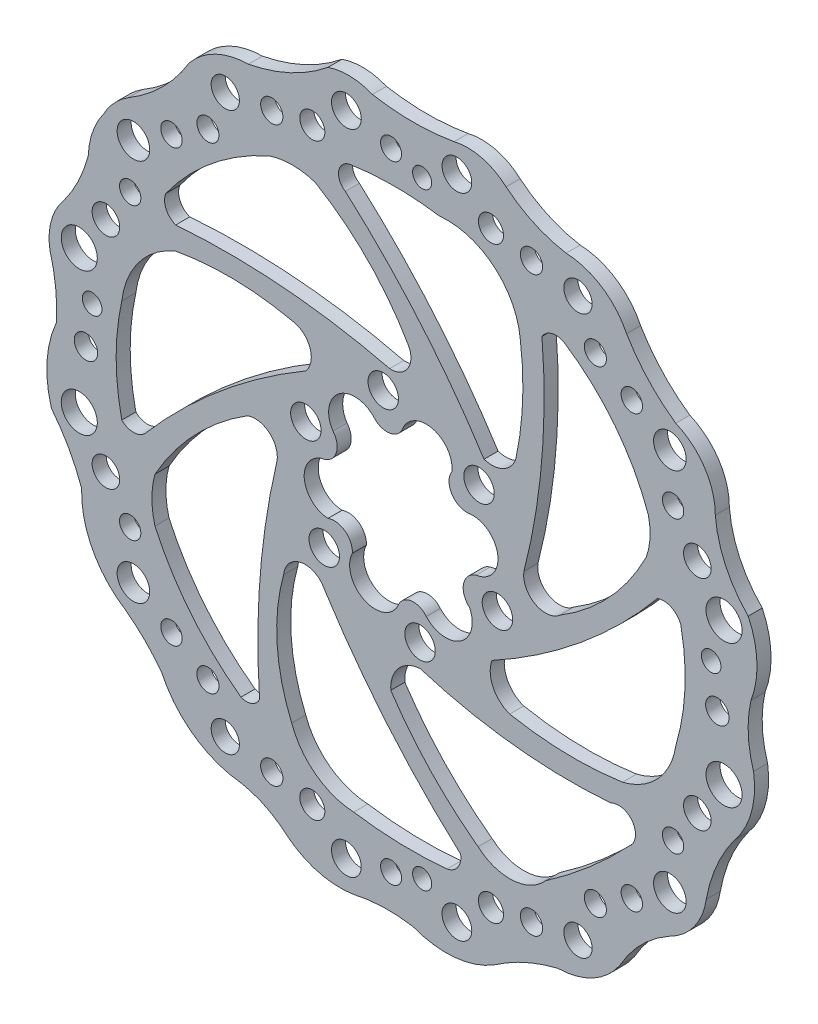
from build123d import *

# Parameters (mm, degrees)
SKETCH1_R           = 6.5
SKETCH1_R_2         = 4.481947624
SKETCH1_R_3         = 6.35186307
SKETCH1_R_4         = 5.36297544
SKETCH1_R_5         = 4.752571072
SKETCH1_R_6         = 6.034660393
SKETCH1_R_7         = 4.711694859
SKETCH1_R_8         = 4.568836388
SKETCH1_R_9         = 6.955138289
SKETCH1_R_10        = 4.546098943
SKETCH1_R_11        = 5.888741898
SKETCH1_R_12        = 7.697725545
SKETCH1_R_13        = 4.187790607
SKETCH1_R_14        = 4.997388646
SKETCH1_R_15        = 4.085578702
BOSS_EXTRUDE2_DEPTH = 3


with BuildPart() as part:
    # Sketch1 → Boss-Extrude2 (new, symmetric)
    with BuildSketch(Plane.XY):
        with BuildLine():
            ThreePointArc((172.350342113, 327.34395255), (189.792648498, 325.821275321), (207.234954883, 327.34395255))
            ThreePointArc((207.234954883, 327.34395255), (219.015216566, 327.281821878), (229.409780821, 321.738225618))
            ThreePointArc((229.409780821, 321.738225618), (241.459015471, 314.184773084), (255.061078746, 310.03476399))
            ThreePointArc((255.061078746, 310.03476399), (270.29477263, 305.152223351), (280.861682999, 293.142017787))
            ThreePointArc((280.861682999, 293.142017787), (290.151319123, 280.706355127), (301.876022337, 270.534119401))
            ThreePointArc((301.876022337, 270.534119401), (314.163240434, 260.322012276), (318.738374685, 245.014138255))
            ThreePointArc((318.738374685, 245.014138255), (323.07477683, 228.616061419), (332.781486376, 214.706313137))
            ThreePointArc((332.781486376, 214.706313137), (336.51503141, 199.537502908), (333.948220238, 184.128296481))
            ThreePointArc((333.948220238, 184.128296481), (332.792590019, 171.209937928), (335.075020626, 158.442401775))
            ThreePointArc((335.075020626, 158.442401775), (334.129513492, 142.749121234), (326.806455933, 128.837044975))
            ThreePointArc((326.806455933, 128.837044975), (319.263587138, 115.611489099), (314.874222145, 101.032611472))
            ThreePointArc((314.874222145, 101.032611472), (309.74568747, 88.426029493), (299.341365826, 79.652326272))
            ThreePointArc((299.341365826, 79.652326272), (287.29663412, 70.594339905), (278.219980867, 58.563668908))
            ThreePointArc((278.219980867, 58.563668908), (266.698768681, 47.880815611), (251.507672256, 43.869297916))
            ThreePointArc((251.507672256, 43.869297916), (237.288038306, 38.946368842), (224.232123852, 31.464636551))
            ThreePointArc((224.232123852, 31.464636551), (207.374916388, 25.894164093), (189.792648498, 28.355761689))
            ThreePointArc((189.792648498, 28.355761689), (177.041723424, 29.224341658), (164.363564761, 27.610397941))
            ThreePointArc((164.363564761, 27.610397941), (149.22659025, 28.348787151), (135.742268955, 35.2658888))
            ThreePointArc((135.742268955, 35.2658888), (126.646470671, 41.344407243), (116.256066373, 44.768064851))
            ThreePointArc((116.256066373, 44.768064851), (96.208650376, 52.227788257), (82.441300883, 68.598690779))
            ThreePointArc((82.441300883, 68.598690779), (75.328713133, 76.860637393), (67.072033423, 83.979338574))
            ThreePointArc((67.072033423, 83.979338574), (52.923439027, 99.282859112), (48.236030898, 119.590706592))
            ThreePointArc((48.236030898, 119.590706592), (42.787599149, 131.721511906), (35.355662752, 142.749121234))
            ThreePointArc((35.355662752, 142.749121234), (33.44489989, 159.318141069), (37.435678979, 175.512495494))
            ThreePointArc((37.435678979, 175.512495494), (37.148765664, 188.386574669), (34.68303781, 201.025578587))
            ThreePointArc((34.68303781, 201.025578587), (35.261307716, 212.191830898), (40.468185367, 222.086678644))
            ThreePointArc((40.468185367, 222.086678644), (46.81490189, 232.527351608), (51.041994988, 243.991214242))
            ThreePointArc((51.041994988, 243.991214242), (52.913352273, 253.84211016), (57.576312969, 262.718986076))
            ThreePointArc((57.576312969, 262.718986076), (62.139361949, 269.102076501), (68.199092561, 274.086544807))
            ThreePointArc((68.199092561, 274.086544807), (82.782196603, 285.384887438), (94.146394809, 299.91673071))
            ThreePointArc((94.146394809, 299.91673071), (105.416766064, 308.798428302), (119.390447461, 312.060643582))
            ThreePointArc((119.390447461, 312.060643582), (137.360175595, 317.866814399), (153.369400866, 327.88317377))
            ThreePointArc((153.369400866, 327.88317377), (162.909186019, 329.349467006), (172.350342113, 327.34395255))
        make_face()
        with Locations((143.945709707, 192.180819243)):
            Circle(SKETCH1_R, mode=Mode.SUBTRACT)
        with Locations((176.981255574, 220.324862426)):
            Circle(SKETCH1_R, mode=Mode.SUBTRACT)
        with Locations((217.872484869, 205.787262068)):
            Circle(SKETCH1_R, mode=Mode.SUBTRACT)
        with Locations((225.728168296, 163.105618528)):
            Circle(SKETCH1_R, mode=Mode.SUBTRACT)
        with Locations((192.692622429, 134.961575345)):
            Circle(SKETCH1_R, mode=Mode.SUBTRACT)
        with Locations((151.801393134, 149.499175703)):
            Circle(SKETCH1_R, mode=Mode.SUBTRACT)
        with Locations((180.326307765, 311.417139854)):
            Circle(SKETCH1_R_2, mode=Mode.SUBTRACT)
        with Locations((161.251730048, 315.899087478)):
            Circle(SKETCH1_R_3, mode=Mode.SUBTRACT)
        with Locations((146.697654266, 303.201119754)):
            Circle(SKETCH1_R_4, mode=Mode.SUBTRACT)
        with Locations((129.40234235, 299.91673071)):
            Circle(SKETCH1_R_5, mode=Mode.SUBTRACT)
        with Locations((109.557694111, 296.722768863)):
            Circle(SKETCH1_R_6, mode=Mode.SUBTRACT)
        with Locations((102.135844123, 279.443566222)):
            Circle(SKETCH1_R_7, mode=Mode.SUBTRACT)
        with Locations((86.575288189, 269.727623493)):
            Circle(SKETCH1_R_8, mode=Mode.SUBTRACT)
        with Locations((70.332512178, 259.402493017)):
            Circle(SKETCH1_R_9, mode=Mode.SUBTRACT)
        with Locations((68.953513016, 239.56336278)):
            Circle(SKETCH1_R_10, mode=Mode.SUBTRACT)
        with Locations((58.601255904, 224.282246489)):
            Circle(SKETCH1_R_11, mode=Mode.SUBTRACT)
        with Locations((47.213004117, 208.025096247)):
            Circle(SKETCH1_R_12, mode=Mode.SUBTRACT)
        with Locations((52.712514006, 190.177835983)):
            Circle(SKETCH1_R_13, mode=Mode.SUBTRACT)
        with Locations((50.067940231, 172.995724188)):
            Circle(SKETCH1_R_14, mode=Mode.SUBTRACT)
        with Locations(Location((208.422147955, 315.899087478, 0), (0, 0, 180))):
            Circle(SKETCH1_R_3, mode=Mode.SUBTRACT)
        with Locations(Location((222.976223738, 303.201119754, 0), (0, 0, 180))):
            Circle(SKETCH1_R_4, mode=Mode.SUBTRACT)
        with Locations(Location((240.271535654, 299.91673071, 0), (0, 0, 180))):
            Circle(SKETCH1_R_5, mode=Mode.SUBTRACT)
        with Locations(Location((260.116183892, 296.722768863, 0), (0, 0, 180))):
            Circle(SKETCH1_R_6, mode=Mode.SUBTRACT)
        with Locations(Location((267.53803388, 279.443566222, 0), (0, 0, 180))):
            Circle(SKETCH1_R_7, mode=Mode.SUBTRACT)
        with Locations(Location((283.098589815, 269.727623493, 0), (0, 0, 180))):
            Circle(SKETCH1_R_8, mode=Mode.SUBTRACT)
        with Locations(Location((299.341365826, 259.402493017, 0), (0, 0, 180))):
            Circle(SKETCH1_R_9, mode=Mode.SUBTRACT)
        with Locations(Location((300.720364988, 239.56336278, 0), (0, 0, 180))):
            Circle(SKETCH1_R_10, mode=Mode.SUBTRACT)
        with Locations(Location((311.072622099, 224.282246489, 0), (0, 0, 180))):
            Circle(SKETCH1_R_11, mode=Mode.SUBTRACT)
        with Locations(Location((322.460873887, 208.025096247, 0), (0, 0, 180))):
            Circle(SKETCH1_R_12, mode=Mode.SUBTRACT)
        with Locations(Location((316.961363998, 190.177835983, 0), (0, 0, 180))):
            Circle(SKETCH1_R_13, mode=Mode.SUBTRACT)
        with Locations(Location((319.605937773, 172.995724188, 0), (0, 0, 180))):
            Circle(SKETCH1_R_14, mode=Mode.SUBTRACT)
        with Locations((193.589999076, 307.24781596)):
            Circle(SKETCH1_R_15, mode=Mode.SUBTRACT)
        with Locations((322.460873887, 147.261341524)):
            Circle(SKETCH1_R_12, mode=Mode.SUBTRACT)
        with Locations((311.072622099, 131.004191282)):
            Circle(SKETCH1_R_11, mode=Mode.SUBTRACT)
        with Locations((300.720364988, 115.723074991)):
            Circle(SKETCH1_R_10, mode=Mode.SUBTRACT)
        with Locations((299.341365826, 95.883944753)):
            Circle(SKETCH1_R_9, mode=Mode.SUBTRACT)
        with Locations((283.098589815, 85.558814278)):
            Circle(SKETCH1_R_8, mode=Mode.SUBTRACT)
        with Locations((267.53803388, 75.842871549)):
            Circle(SKETCH1_R_7, mode=Mode.SUBTRACT)
        with Locations((260.116183892, 58.563668908)):
            Circle(SKETCH1_R_6, mode=Mode.SUBTRACT)
        with Locations((240.271535654, 55.369707061)):
            Circle(SKETCH1_R_5, mode=Mode.SUBTRACT)
        with Locations((222.976223738, 52.085318017)):
            Circle(SKETCH1_R_4, mode=Mode.SUBTRACT)
        with Locations((208.422147955, 39.387350293)):
            Circle(SKETCH1_R_3, mode=Mode.SUBTRACT)
        with Locations(Location((193.589999076, 48.038621811, 0), (0, 0, 180))):
            Circle(SKETCH1_R_15, mode=Mode.SUBTRACT)
        with Locations(Location((180.326307765, 43.869297916, 0), (0, 0, 180))):
            Circle(SKETCH1_R_2, mode=Mode.SUBTRACT)
        with Locations(Location((161.251730048, 39.387350293, 0), (0, 0, 180))):
            Circle(SKETCH1_R_3, mode=Mode.SUBTRACT)
        with Locations(Location((146.697654266, 52.085318017, 0), (0, 0, 180))):
            Circle(SKETCH1_R_4, mode=Mode.SUBTRACT)
        with Locations(Location((129.40234235, 55.369707061, 0), (0, 0, 180))):
            Circle(SKETCH1_R_5, mode=Mode.SUBTRACT)
        with Locations(Location((109.557694111, 58.563668908, 0), (0, 0, 180))):
            Circle(SKETCH1_R_6, mode=Mode.SUBTRACT)
        with Locations(Location((102.135844123, 75.842871549, 0), (0, 0, 180))):
            Circle(SKETCH1_R_7, mode=Mode.SUBTRACT)
        with Locations(Location((86.575288189, 85.558814278, 0), (0, 0, 180))):
            Circle(SKETCH1_R_8, mode=Mode.SUBTRACT)
        with Locations(Location((70.332512178, 95.883944753, 0), (0, 0, 180))):
            Circle(SKETCH1_R_9, mode=Mode.SUBTRACT)
        with Locations(Location((68.953513016, 115.723074991, 0), (0, 0, 180))):
            Circle(SKETCH1_R_10, mode=Mode.SUBTRACT)
        with Locations(Location((58.601255904, 131.004191282, 0), (0, 0, 180))):
            Circle(SKETCH1_R_11, mode=Mode.SUBTRACT)
        with Locations(Location((47.213004117, 147.261341524, 0), (0, 0, 180))):
            Circle(SKETCH1_R_12, mode=Mode.SUBTRACT)
        with BuildLine():
            ThreePointArc((84.107452439, 246.590657076), (103.794643646, 267.555316157), (128.297980607, 282.611507767))
            ThreePointArc((128.297980607, 282.611507767), (138.138728476, 284.205469142), (147.979476346, 282.611507767))
            ThreePointArc((147.979476346, 282.611507767), (170.433622336, 265.063843476), (187.680638771, 242.377953184))
            ThreePointArc((187.680638771, 242.377953184), (187.512126457, 233.649741468), (179.729813811, 229.694278659))
            ThreePointArc((179.729813811, 229.694278659), (134.347080523, 237.014015078), (88.377965666, 237.121258183))
            ThreePointArc((88.377965666, 237.121258183), (84.281532328, 240.971505381), (84.107452439, 246.590657076))
        make_face(mode=Mode.SUBTRACT)
        with BuildLine():
            ThreePointArc((162.833435394, 296.722768863), (181.865070424, 298.148045763), (200.896705454, 296.722768863))
            ThreePointArc((200.896705454, 296.722768863), (223.932599684, 289.949709133), (235.432160241, 268.871595648))
            ThreePointArc((235.432160241, 268.871595648), (236.497549069, 245.952586405), (233.57541536, 223.195671575))
            ThreePointArc((233.57541536, 223.195671575), (228.22111103, 216.953519018), (220.021177728, 216.325715515))
            ThreePointArc((220.021177728, 216.325715515), (192.796194147, 253.085457168), (160.791016024, 285.767974065))
            ThreePointArc((160.791016024, 285.767974065), (157.981948718, 291.959490903), (162.833435394, 296.722768863))
        make_face(mode=Mode.SUBTRACT)
        with BuildLine():
            ThreePointArc((244.734758604, 274.086544807), (244.686972852, 228.44735414), (237.054322286, 183.450902575))
            ThreePointArc((237.054322286, 183.450902575), (241.695392303, 173.7820889), (252.365253245, 174.868162681))
            ThreePointArc((252.365253245, 174.868162681), (273.625665271, 192.170435418), (289.230407398, 214.706313137))
            ThreePointArc((289.230407398, 214.706313137), (290.874640291, 222.741767505), (290.122306289, 230.909142987))
            ThreePointArc((290.122306289, 230.909142987), (275.934998039, 256.65107094), (254.297700841, 276.544636233))
            ThreePointArc((254.297700841, 276.544636233), (249.00714232, 277.296140705), (244.734758604, 274.086544807))
        make_face(mode=Mode.SUBTRACT)
        with BuildLine():
            ThreePointArc((138.138728476, 226.537812361), (113.303441573, 229.481745699), (88.377965666, 227.437517285))
            ThreePointArc((88.377965666, 227.437517285), (72.784924026, 215.636053302), (65.377201021, 197.537900369))
            ThreePointArc((65.377201021, 197.537900369), (62.956372381, 175.512495494), (65.377201021, 153.487090619))
            ThreePointArc((65.377201021, 153.487090619), (70.332512178, 151.434533532), (75.287823334, 153.487090619))
            ThreePointArc((75.287823334, 153.487090619), (107.222137522, 185.085555599), (143.945709707, 210.963010222))
            ThreePointArc((143.945709707, 210.963010222), (145.667278045, 220.474839653), (138.138728476, 226.537812361))
        make_face(mode=Mode.SUBTRACT)
        with BuildLine():
            ThreePointArc((119.024369519, 181.920068318), (96.675724074, 163.721306781), (79.529911303, 140.554995484))
            ThreePointArc((79.529911303, 140.554995484), (78.20730234, 130.958211244), (79.529911303, 121.361427005))
            ThreePointArc((79.529911303, 121.361427005), (94.972662474, 96.546628533), (116.256066373, 76.51491604))
            ThreePointArc((116.256066373, 76.51491604), (120.873746483, 76.440062675), (124.191868725, 79.652326272))
            ThreePointArc((124.191868725, 79.652326272), (124.405844247, 125.280352497), (131.389456904, 170.371279711))
            ThreePointArc((131.389456904, 170.371279711), (128.745575486, 179.934458253), (119.024369519, 181.920068318))
        make_face(mode=Mode.SUBTRACT)
        with BuildLine():
            ThreePointArc((134.48231962, 130.958211244), (131.659047362, 104.053074582), (137.905176738, 77.731161412))
            ThreePointArc((137.905176738, 77.731161412), (148.151941306, 63.877712956), (164.363564761, 58.038407928))
            ThreePointArc((164.363564761, 58.038407928), (184.241677232, 56.279533451), (204.186550019, 56.939112389))
            ThreePointArc((204.186550019, 56.939112389), (208.836249972, 59.911255863), (210.022461534, 65.300713035))
            ThreePointArc((210.022461534, 65.300713035), (178.569774103, 97.794812056), (151.801393134, 134.244665253))
            ThreePointArc((151.801393134, 134.244665253), (141.911362259, 139.085940404), (134.48231962, 130.958211244))
        make_face(mode=Mode.SUBTRACT)
        with BuildLine():
            ThreePointArc((192.692622429, 125.280352497), (233.023622696, 116.942113808), (274.202837909, 116.319184054))
            ThreePointArc((274.202837909, 116.319184054), (283.507983553, 113.869307497), (281.999631564, 104.366018336))
            ThreePointArc((281.999631564, 104.366018336), (264.939450263, 88.041212572), (246.257241663, 73.600847234))
            ThreePointArc((246.257241663, 73.600847234), (232.224383228, 66.742480643), (217.452056345, 71.815612478))
            ThreePointArc((217.452056345, 71.815612478), (197.109126429, 89.771172337), (180.194589045, 110.98756582))
            ThreePointArc((180.194589045, 110.98756582), (183.483472694, 120.722386624), (192.692622429, 125.280352497))
        make_face(mode=Mode.SUBTRACT)
        with BuildLine():
            ThreePointArc((294.07747631, 201.886064093), (261.49171038, 169.38681677), (223.363318514, 143.613595172))
            ThreePointArc((223.363318514, 143.613595172), (223.842681997, 134.024677853), (230.962031626, 127.583250561))
            ThreePointArc((230.962031626, 127.583250561), (254.994787245, 125.01471722), (279.119903456, 126.480825663))
            ThreePointArc((279.119903456, 126.480825663), (294.319528161, 135.458340442), (301.876022337, 151.412141198))
            ThreePointArc((301.876022337, 151.412141198), (305.771024991, 174.077484423), (304.042285122, 197.01000037))
            ThreePointArc((304.042285122, 197.01000037), (300.069746579, 201.51181171), (294.07747631, 201.886064093))
        make_face(mode=Mode.SUBTRACT)
        with BuildLine():
            ThreePointArc((173.314920632, 208.025096247), (158.080080347, 209.564469289), (155.531548549, 194.465627826))
            ThreePointArc((155.531548549, 194.465627826), (156.756216795, 186.684058358), (150.482698277, 181.920068318))
            ThreePointArc((150.482698277, 181.920068318), (143.329878926, 170.335498201), (153.369400866, 161.139135406))
            ThreePointArc((153.369400866, 161.139135406), (160.662639123, 160.127084478), (163.813498786, 153.472187428))
            ThreePointArc((163.813498786, 153.472187428), (168.579533483, 138.847560474), (183.204160437, 143.613595172))
            ThreePointArc((183.204160437, 143.613595172), (188.618167047, 148.362391992), (195.361049982, 145.833347006))
            ThreePointArc((195.361049982, 145.833347006), (210.046856592, 144.148848296), (213.815779597, 158.442401775))
            ThreePointArc((213.815779597, 158.442401775), (211.280221952, 165.973127479), (216.683713605, 171.79920336))
            ThreePointArc((216.683713605, 171.79920336), (225.878836208, 183.862259971), (213.815779597, 193.057382574))
            ThreePointArc((213.815779597, 193.057382574), (206.235216128, 196.611599532), (206.341392057, 204.98334531))
            ThreePointArc((206.341392057, 204.98334531), (198.40726052, 216.53763931), (185.547413568, 210.963010222))
            ThreePointArc((185.547413568, 210.963010222), (180.287002824, 205.930639013), (173.314920632, 208.025096247))
        make_face(mode=Mode.SUBTRACT)
    extrude(amount=BOSS_EXTRUDE2_DEPTH, both=True)


solid = part.part
